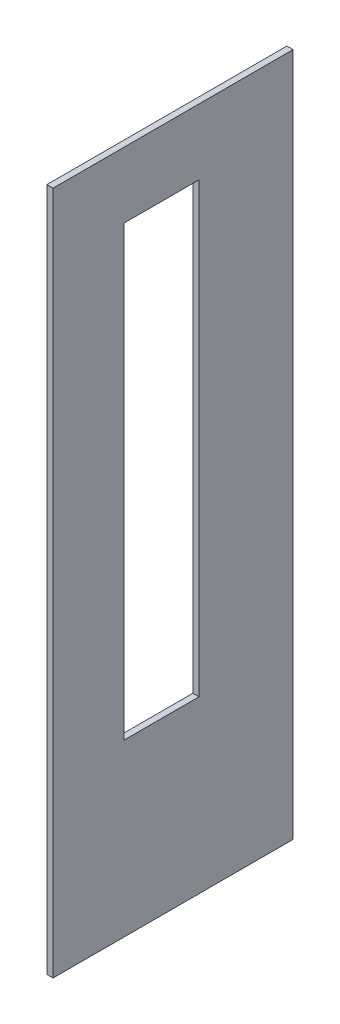
from build123d import *

# Parameters (mm, degrees)
SKETCH_1_W          = 110.7
SKETCH_1_H          = 38.85
EXTRUDE_1_DEPTH     = 1
SKETCH_2_W          = 12.12
SKETCH_2_H          = 72.46
CUT_EXTRUDE_1_DEPTH = 10


with BuildPart() as part:
    # Эскиз1 → Бобышка-Вытянуть1 (new body)
    with BuildSketch(Plane(origin=(0.5, 0, 0), x_dir=(0, -1, 0), z_dir=(-1, 0, 0))):
        with Locations((-45.5, 22.825)):
            Rectangle(SKETCH_1_W, SKETCH_1_H)
    extrude(amount=-EXTRUDE_1_DEPTH)

    # Эскиз2 → Вырез-Вытянуть1 (cut)
    with BuildSketch(Plane.ZY.offset(-0.5)):
        with Locations((24.69, 53.98)):
            Rectangle(SKETCH_2_W, SKETCH_2_H)
    extrude(amount=-CUT_EXTRUDE_1_DEPTH, mode=Mode.SUBTRACT)


solid = part.part
